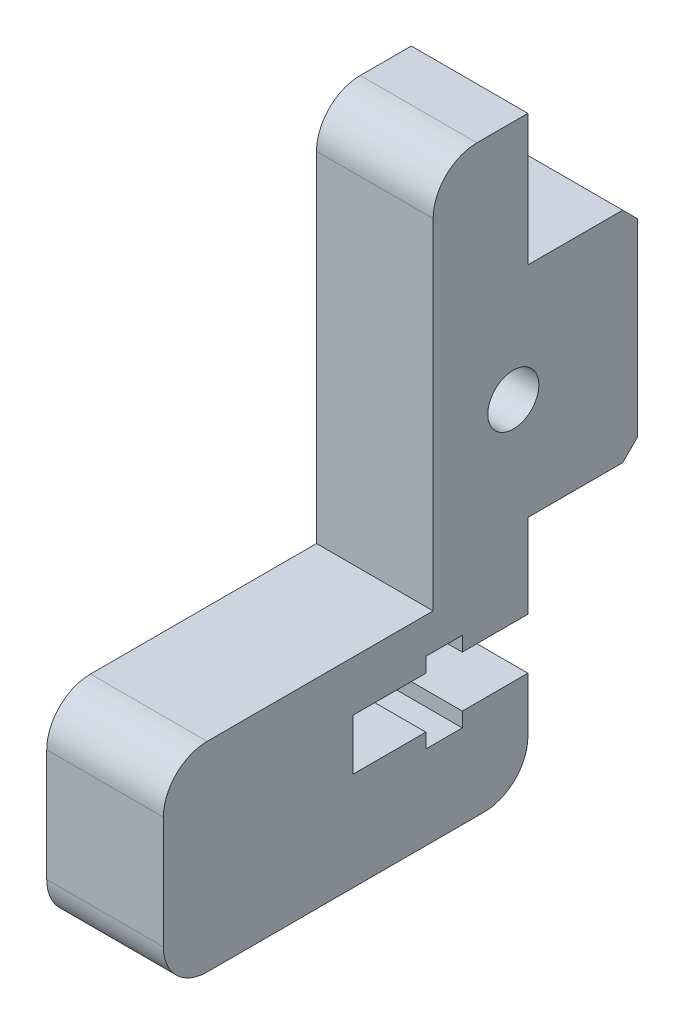
from build123d import *

# Parameters (mm, degrees)
SKETCH1_R      = 1.75
EXTRUDE1_DEPTH = 8
SKETCH2_R      = 1
EXTRUDE2_DEPTH = 1


with BuildPart() as part:
    # Sketch1 → Extrude1 (new body)
    with BuildSketch(Plane(origin=(0, 0, 0), x_dir=(0, 0, -1), z_dir=(1, 0, 0))):
        with BuildLine():
            Line((28.082940188, 19.097217002), (34.582940188, 19.097217002))
            Line((34.582940188, 19.097217002), (35.582940188, 20.097217002))
            Line((35.582940188, 20.097217002), (35.582940188, 33.097217002))
            Line((35.582940188, 33.097217002), (34.582940188, 34.097217002))
            Line((34.582940188, 34.097217002), (28.082940188, 34.097217002))
            Line((28.082940188, 34.097217002), (28.082940188, 43.097217002))
            Line((28.082940188, 43.097217002), (24.582940188, 43.097217002))
            ThreePointArc((24.582940188, 43.097217002), (22.461619844, 42.218537346), (21.582940188, 40.097217002))
            Line((21.582940188, 40.097217002), (21.582940188, 16.797217002))
            Line((21.582940188, 16.797217002), (6.082940188, 16.797217002))
            ThreePointArc((6.082940188, 16.797217002), (3.961619844, 15.918537346), (3.082940188, 13.797217002))
            Line((3.082940188, 13.797217002), (3.082940188, 6.097217002))
            ThreePointArc((3.082940188, 6.097217002), (3.961619844, 3.975896659), (6.082940188, 3.097217002))
            Line((6.082940188, 3.097217002), (25.082940188, 3.097217002))
            ThreePointArc((25.082940188, 3.097217002), (27.204260531, 3.975896659), (28.082940188, 6.097217002))
            Line((28.082940188, 6.097217002), (28.082940188, 9.847217002))
            Line((28.082940188, 9.847217002), (23.582940188, 9.847217002))
            Line((23.582940188, 9.847217002), (23.582940188, 8.847217002))
            Line((23.582940188, 8.847217002), (21.082940188, 8.847217002))
            Line((21.082940188, 8.847217002), (21.082940188, 9.847217002))
            Line((21.082940188, 9.847217002), (16.082940188, 9.847217002))
            Line((16.082940188, 9.847217002), (16.082940188, 13.347217002))
            Line((16.082940188, 13.347217002), (21.082940188, 13.347217002))
            Line((21.082940188, 13.347217002), (21.082940188, 14.347217002))
            Line((21.082940188, 14.347217002), (23.582940188, 14.347217002))
            Line((23.582940188, 14.347217002), (23.582940188, 13.347217002))
            Line((23.582940188, 13.347217002), (28.082940188, 13.347217002))
            Line((28.082940188, 13.347217002), (28.082940188, 19.097217002))
        make_face()
        with Locations((27.082940188, 26.597217002)):
            Circle(SKETCH1_R, mode=Mode.SUBTRACT)
    extrude(amount=EXTRUDE1_DEPTH)

    # Sketch2 → Extrude2 (cut)
    with BuildSketch(Plane(origin=(0, 0, -16.082940188), x_dir=(-1, 0, 0), z_dir=(0, 0, -1))):
        with Locations((-4, 11.597217002)):
            Circle(SKETCH2_R)
    extrude(amount=-EXTRUDE2_DEPTH, mode=Mode.SUBTRACT)


solid = part.part
